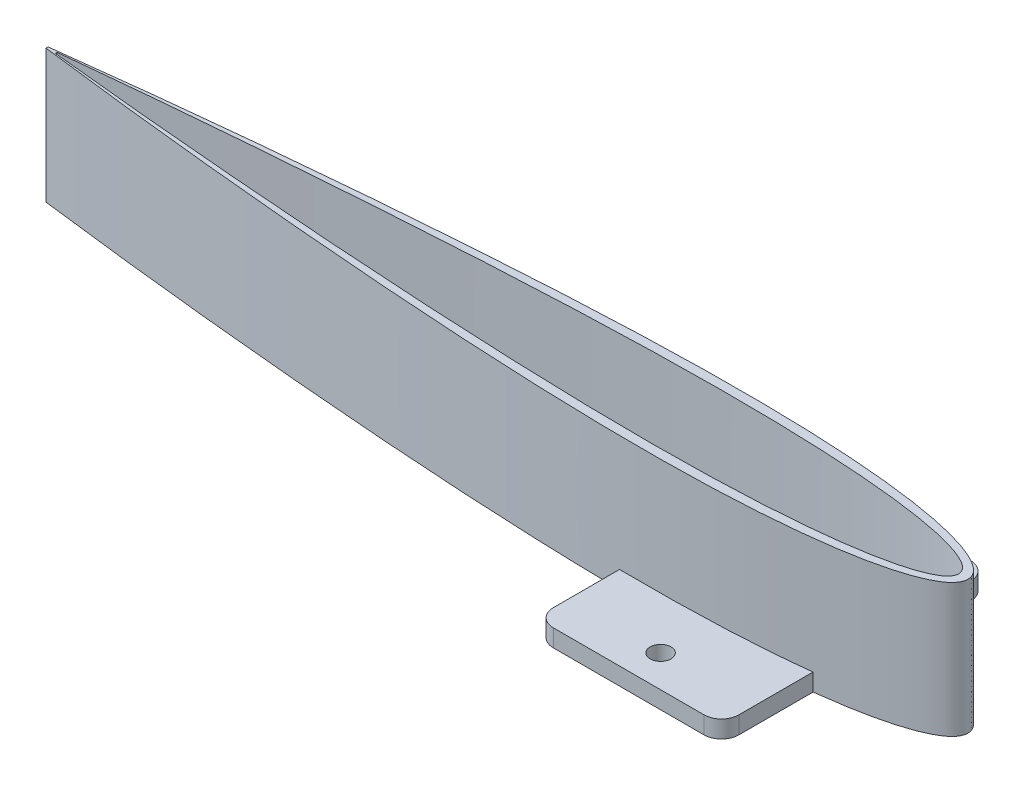
from build123d import *

# Parameters (mm, degrees)
BOSS_EXTRUDE1_DEPTH = 23
BOSS_EXTRUDE2_DEPTH = 3
CUT_EXTRUDE1_DEPTH  = 20
SKETCH4_R           = 1.8
CUT_EXTRUDE2_DEPTH  = 3


with BuildPart() as part:
    # Sketch1 → Boss-Extrude1 (new body)
    with BuildSketch(Plane(origin=(0, 0, 0), x_dir=(1, 0, 0), z_dir=(0, 1, 0))):
        with BuildLine():
            Line((-157.192, 0.18063444), (-157.192, -0.18063444))
            add(Edge.make_bspline(
                [(-157.192, 0.18063444), (-157.047021594, 0.198980184), (-156.468742019, 0.272156386), (-155.173560807, 0.434796155), (-153.030691458, 0.700413761), (-150.063574609, 1.061009797), (-146.304700608, 1.506363727), (-141.795230181, 2.024419489), (-136.584560061, 2.601976702), (-130.729778213, 3.225125798), (-124.295038634, 3.879553472), (-117.350854019, 4.550624951), (-109.973317818, 5.22329222), (-102.243264033, 5.8818892), (-94.245375183, 6.509917176), (-86.067249162, 7.089933011), (-77.798436348, 7.603643728), (-69.529458512, 8.032278874), (-61.35082044, 8.357263342), (-53.352024309, 8.561155263), (-45.620593132, 8.628758011), (-38.241112674, 8.548266478), (-31.294277773, 8.312296436), (-24.855993258, 7.918602346), (-18.996334865, 7.370472964), (-13.778916, 6.676345659), (-9.25865361, 5.849862158), (-5.4833427, 4.906565956), (-2.480734642, 3.868023169), (-0.276087031, 2.738144074), (1.189115548, 1.515461858), (1.778258751, 0), (1.189115548, -1.515461858), (-0.276087031, -2.738144074), (-2.480734642, -3.868023169), (-5.4833427, -4.906565956), (-9.25865361, -5.849862158), (-13.778916, -6.676345659), (-18.996334865, -7.370472964), (-24.855993258, -7.918602346), (-31.294277773, -8.312296436), (-38.241112674, -8.548266478), (-45.620593132, -8.628758011), (-53.352024309, -8.561155263), (-61.35082044, -8.357263342), (-69.529458512, -8.032278874), (-77.798436348, -7.603643728), (-86.067249162, -7.089933011), (-94.245375183, -6.509917176), (-102.243264033, -5.8818892), (-109.973317818, -5.22329222), (-117.350854019, -4.550624951), (-124.295038634, -3.879553472), (-130.729778213, -3.225125798), (-136.584560061, -2.601976702), (-141.795230181, -2.024419489), (-146.304700608, -1.506363727), (-150.063574609, -1.061009797), (-153.030691458, -0.700413761), (-155.173560807, -0.434796155), (-156.468742019, -0.272156386), (-157.047021594, -0.198980184), (-157.192, -0.18063444)],
                knots=[0, 0, 0, 0, 0.001358245, 0.005417671, 0.012132576, 0.021427518, 0.033198364, 0.047313662, 0.063616285, 0.081925299, 0.102038, 0.123732134, 0.146768286, 0.17089245, 0.19583881, 0.221332735, 0.247093996, 0.272840174, 0.298290212, 0.323168023, 0.347206052, 0.37014868, 0.391755406, 0.411803803, 0.430092427, 0.446444057, 0.46071013, 0.472778246, 0.48258749, 0.490165502, 0.495733386, 0.5, 0.504266614, 0.509834498, 0.51741251, 0.527221754, 0.53928987, 0.553555943, 0.569907573, 0.588196197, 0.608244594, 0.62985132, 0.652793948, 0.676831977, 0.701709788, 0.727159826, 0.752906004, 0.778667265, 0.80416119, 0.82910755, 0.853231714, 0.876267866, 0.897962, 0.918074701, 0.936383715, 0.952686338, 0.966801636, 0.978572482, 0.987867424, 0.994582329, 0.998641755, 1, 1, 1, 1], degree=3))
        make_face()
    extrude(amount=BOSS_EXTRUDE1_DEPTH)

    # Sketch2 → Boss-Extrude2 (add)
    with BuildSketch(Plane(origin=(0, 0, 0), x_dir=(1, 0, 0), z_dir=(0, 1, 0))):
        with BuildLine():
            Line((-46.9, -23), (-20.9, -23))
            ThreePointArc((-20.9, -23), (-18.778679656, -22.121320344), (-17.9, -20))
            Line((-17.9, -20), (-17.9, 20))
            ThreePointArc((-17.9, 20), (-18.778679656, 22.121320344), (-20.9, 23))
            Line((-20.9, 23), (-46.9, 23))
            ThreePointArc((-46.9, 23), (-49.021320344, 22.121320344), (-49.9, 20))
            Line((-49.9, 20), (-49.9, -20))
            ThreePointArc((-49.9, -20), (-49.021320344, -22.121320344), (-46.9, -23))
        make_face()
    extrude(amount=BOSS_EXTRUDE2_DEPTH)

    # Sketch3 → Cut-Extrude1 (cut)
    with BuildSketch(Plane(origin=(0, 23, 0), x_dir=(1, 0, 0), z_dir=(0, 1, 0))):
        with BuildLine():
            Line((-155.592, 0.14703444), (-155.592, -0.14703444))
            add(Edge.make_bspline(
                [(-155.592, 0.14703444), (-155.449942782, 0.161967719), (-154.883301329, 0.221533963), (-153.614183427, 0.353924802), (-151.51443766, 0.57014063), (-148.607044046, 0.863668605), (-144.923844343, 1.226188564), (-140.505177309, 1.647886174), (-135.399448021, 2.118016105), (-129.662595094, 2.625256057), (-123.357477981, 3.157955349), (-116.553185242, 3.704201703), (-109.324273932, 4.251746367), (-101.749948331, 4.787837241), (-93.913187842, 5.299044128), (-85.899834249, 5.771167787), (-77.797649117, 6.189317139), (-69.69535233, 6.538212785), (-61.68165233, 6.802735443), (-53.844278358, 6.968689938), (-46.269021341, 7.02371248), (-39.038796032, 6.95820084), (-32.232707319, 6.766167963), (-25.925193755, 6.445782458), (-20.184996543, 5.9998575), (-15.07472053, 5.435051523), (-10.648353639, 4.763572803), (-6.954217344, 3.995875481), (-4.019355998, 3.158344263), (-1.875169029, 2.238795554), (-0.446752124, 1.288785144), (0.184699549, 0), (-0.446752124, -1.288785144), (-1.875169029, -2.238795554), (-4.019355998, -3.158344263), (-6.954217344, -3.995875481), (-10.648353639, -4.763572803), (-15.07472053, -5.435051523), (-20.184996543, -5.9998575), (-25.925193755, -6.445782458), (-32.232707319, -6.766167963), (-39.038796032, -6.95820084), (-46.269021341, -7.02371248), (-53.844278358, -6.968689938), (-61.68165233, -6.802735443), (-69.69535233, -6.538212785), (-77.797649117, -6.189317139), (-85.899834249, -5.771167787), (-93.913187842, -5.299044128), (-101.749948331, -4.787837241), (-109.324273932, -4.251746367), (-116.553185242, -3.704201703), (-123.357477981, -3.157955349), (-129.662595094, -2.625256057), (-135.399448021, -2.118016105), (-140.505177309, -1.647886174), (-144.923844343, -1.226188564), (-148.607044046, -0.863668605), (-151.51443766, -0.57014063), (-153.614183427, -0.353924802), (-154.883301329, -0.221533963), (-155.449942782, -0.161967719), (-155.592, -0.14703444)],
                knots=[0, 0, 0, 0, 0.001360811, 0.005428038, 0.012156267, 0.021470482, 0.03326704, 0.047414968, 0.063757539, 0.082114088, 0.102282038, 0.12403911, 0.147145729, 0.171347612, 0.196378555, 0.221963406, 0.247821218, 0.273668571, 0.299222988, 0.324206394, 0.348348543, 0.371390297, 0.393086736, 0.413210068, 0.431552463, 0.44792908, 0.462181893, 0.474185722, 0.483860131, 0.491198837, 0.496361358, 0.5, 0.503638642, 0.508801163, 0.516139869, 0.525814278, 0.537818107, 0.55207092, 0.568447537, 0.586789932, 0.606913264, 0.628609703, 0.651651457, 0.675793606, 0.700777012, 0.726331429, 0.752178782, 0.778036594, 0.803621445, 0.828652388, 0.852854271, 0.87596089, 0.897717962, 0.917885912, 0.936242461, 0.952585032, 0.96673296, 0.978529518, 0.987843733, 0.994571962, 0.998639189, 1, 1, 1, 1], degree=3))
        make_face()
    extrude(amount=-CUT_EXTRUDE1_DEPTH, mode=Mode.SUBTRACT)

    # Sketch4 → Cut-Extrude2 (cut)
    with BuildSketch(Plane(origin=(0, 0, 0), x_dir=(1, 0, 0), z_dir=(0, 1, 0))):
        with Locations(Location((-33.9, -17.5, 0), (0, 0, 270))):
            Circle(SKETCH4_R)
        with Locations(Location((-33.9, 17.5, 0), (0, 0, 270))):
            Circle(SKETCH4_R)
    extrude(amount=CUT_EXTRUDE2_DEPTH, mode=Mode.SUBTRACT)


solid = part.part
